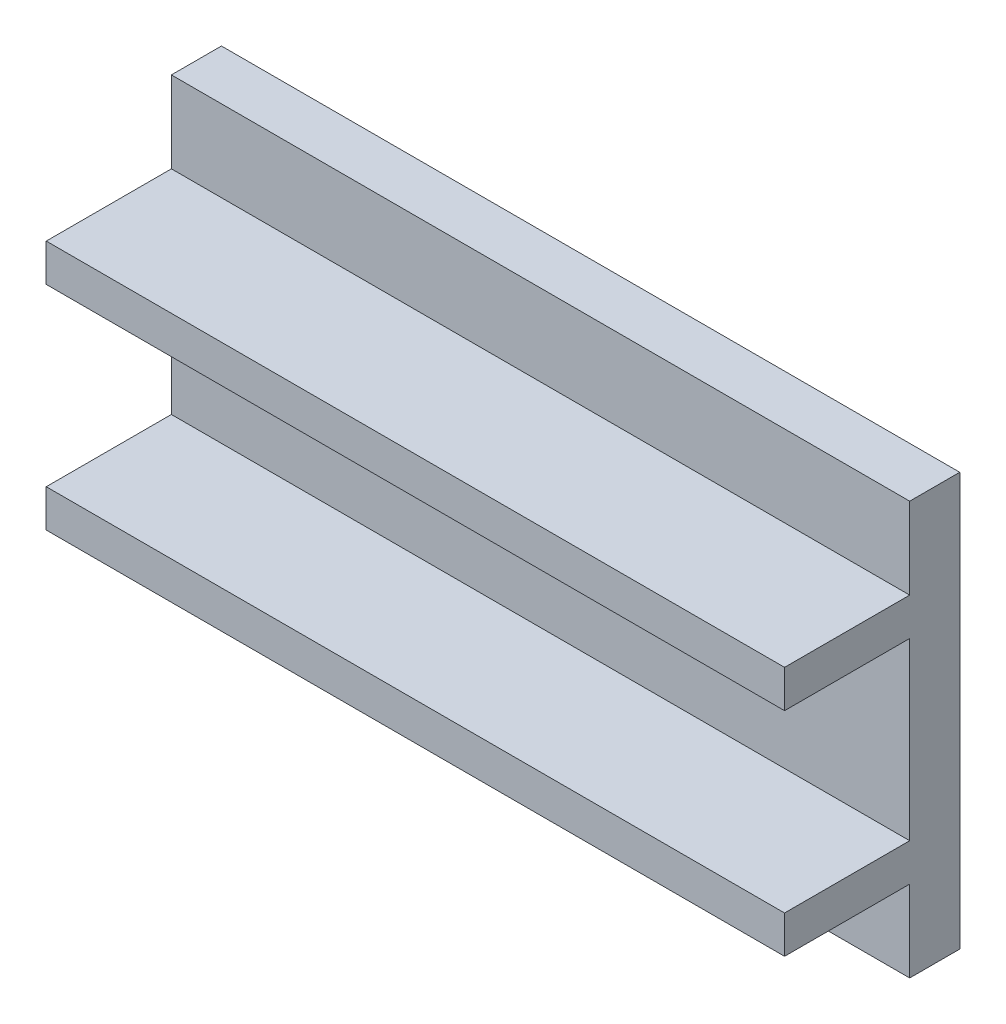
from build123d import *

# Parameters (mm, degrees)
SZKIC1_W                    = 29.5
SZKIC1_H                    = 16.5
DODANIE_WYCI_GNI_CIE1_DEPTH = 2
SZKIC2_W                    = 29.5
SZKIC2_H                    = 1.5
DODANIE_WYCI_GNI_CIE2_DEPTH = 5


with BuildPart() as part:
    # Szkic1 → Dodanie-wyciągnięcie1 (new body)
    with BuildSketch(Plane.XY):
        Rectangle(SZKIC1_W, SZKIC1_H)
    extrude(amount=DODANIE_WYCI_GNI_CIE1_DEPTH)

    # Szkic2 → Dodanie-wyciągnięcie2 (add)
    with BuildSketch(Plane.XY.offset(2)):
        with Locations((0, 4.25)):
            Rectangle(SZKIC2_W, SZKIC2_H)
        with Locations((0, -4.25)):
            Rectangle(SZKIC2_W, SZKIC2_H)
    extrude(amount=DODANIE_WYCI_GNI_CIE2_DEPTH)


solid = part.part
